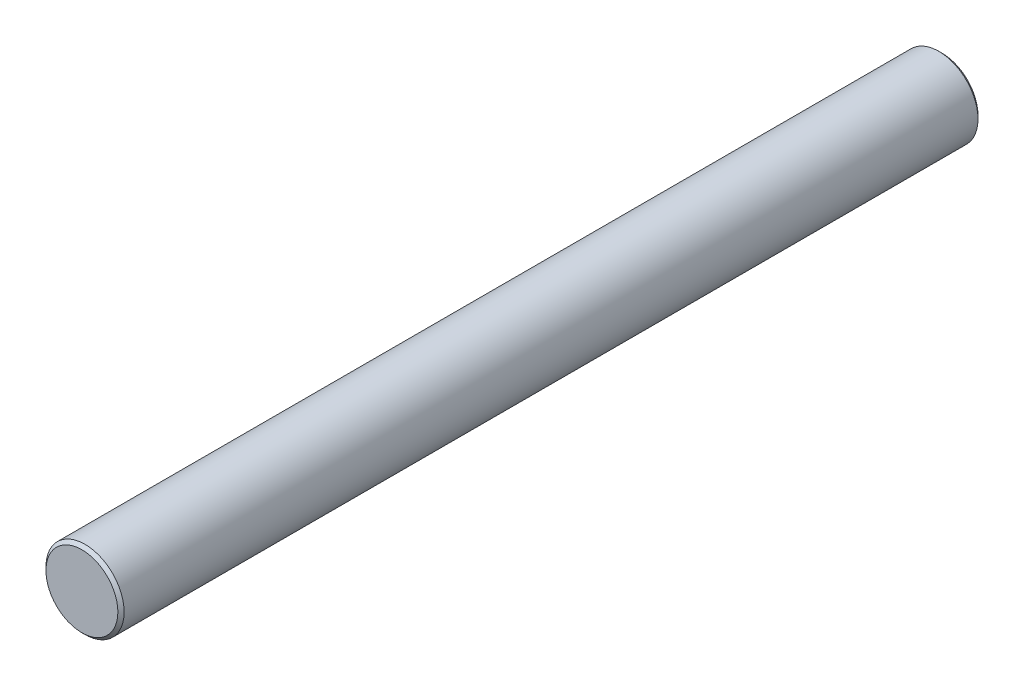
from build123d import *

# Parameters (mm, degrees)
SKETCH_1_R      = 2.5
EXTRUDE_1_DEPTH = 55
CHAMFER_1_SIZE  = 0.2
SCALE_1_SCALE   = 0.6


with BuildPart() as part:
    # 草图1 → 凸台-拉伸1 (new body)
    with BuildSketch(Plane.XY):
        Circle(SKETCH_1_R)
    extrude(amount=EXTRUDE_1_DEPTH)

    # 倒角1
    chamfer_1_edges = [part.edges().sort_by_distance(p)[0] for p in [
        (-2.5, 0, 0),
        (-2.5, 0, 55),
    ]]
    chamfer(chamfer_1_edges, length=CHAMFER_1_SIZE)


with BuildPart() as part_1:
    # 缩放比例1: scaled about (0, 0, 0)
    add(part.part.scale(SCALE_1_SCALE))


solid = part_1.part
